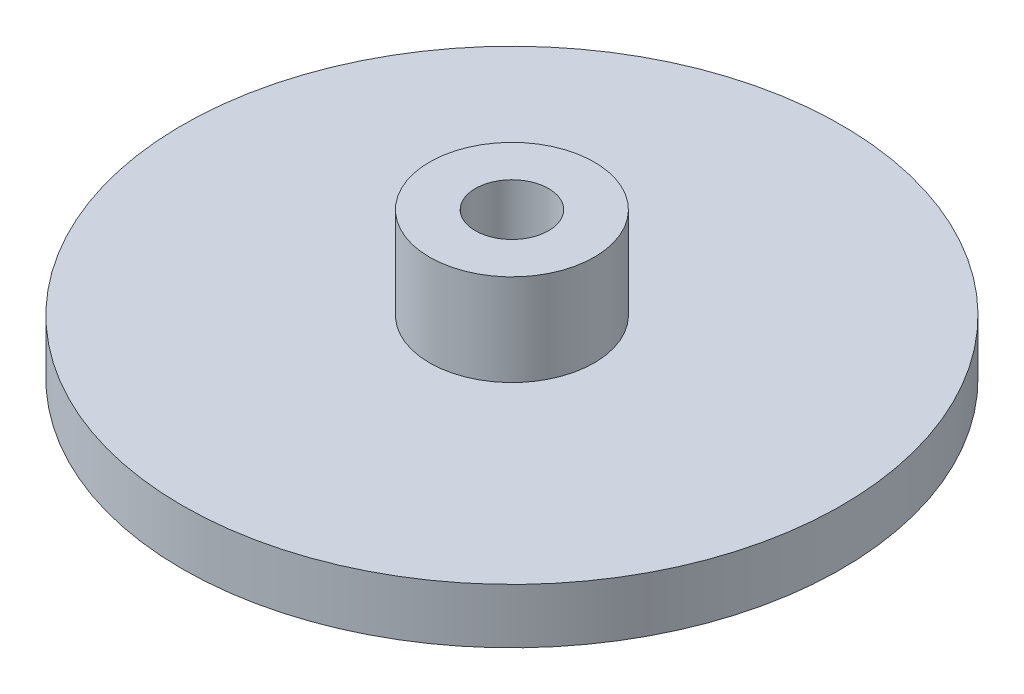
from build123d import *

# Parameters (mm, degrees)
SKETCH1_R           = 36
BOSS_EXTRUDE1_DEPTH = 6
SKETCH2_R           = 9
BOSS_EXTRUDE2_DEPTH = 10
SKETCH3_R           = 4
CUT_EXTRUDE1_DEPTH  = 54.366656257


with BuildPart() as part:
    # Sketch1 → Boss-Extrude1 (new body)
    with BuildSketch(Plane(origin=(0, 0, 0), x_dir=(1, 0, 0), z_dir=(0, 1, 0))):
        with Locations(Location((0, 0, 0), (0, 0, 270))):
            Circle(SKETCH1_R)
    extrude(amount=BOSS_EXTRUDE1_DEPTH)

    # Sketch2 → Boss-Extrude2 (add)
    with BuildSketch(Plane(origin=(0, 6, 0), x_dir=(1, 0, 0), z_dir=(0, 1, 0))):
        with Locations(Location((0, 0, 0), (0, 0, 270))):
            Circle(SKETCH2_R)
    extrude(amount=BOSS_EXTRUDE2_DEPTH)

    # Sketch3 → Cut-Extrude1 (cut, through all)
    with BuildSketch(Plane(origin=(0, 16, 0), x_dir=(1, 0, 0), z_dir=(0, 1, 0))):
        with Locations(Location((0, 0, 0), (0, 0, 270))):
            Circle(SKETCH3_R)
    extrude(amount=-CUT_EXTRUDE1_DEPTH, mode=Mode.SUBTRACT)


solid = part.part
